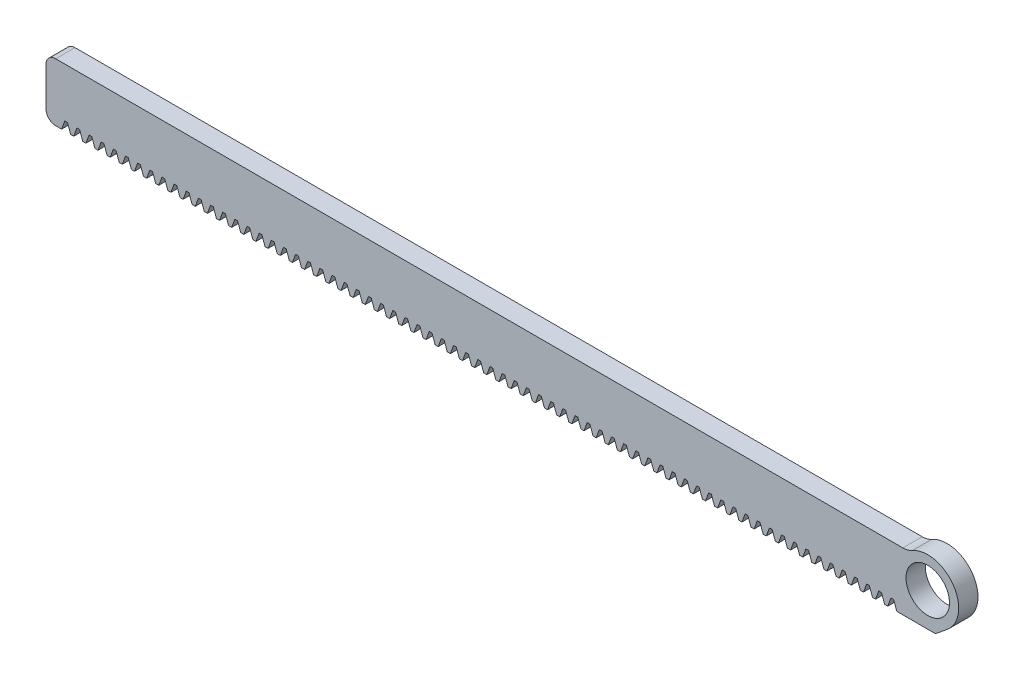
from build123d import *

# Parameters (mm, degrees)
SKETCH1_R           = 14.2875
BOSS_EXTRUDE1_DEPTH = 12.7
FILLET2_R           = 6.35
CUT_EXTRUDE1_DEPTH  = 602.073865732
LPATTERN1_COUNT     = 69
LPATTERN1_PITCH     = 7.979645331


with BuildPart() as part:
    # Sketch1 → Boss-Extrude1 (new body)
    with BuildSketch(Plane.XY):
        with BuildLine():
            Line((0, 38.1), (0, 0))
            Line((0, 0), (584.2, 0))
            Line((584.2, 0), (591.999845733, 6.392013322))
            ThreePointArc((591.999845733, 6.392013322), (595.86597303, 33.618397114), (569.06216832, 39.764856886))
            ThreePointArc((569.06216832, 39.764856886), (566.027460313, 38.523267586), (562.77602352, 38.1))
            Line((562.77602352, 38.1), (0, 38.1))
        make_face()
        with Locations((579.12, 22.108627903)):
            Circle(SKETCH1_R, mode=Mode.SUBTRACT)
    extrude(amount=BOSS_EXTRUDE1_DEPTH)

    # Fillet2
    fillet2_edges = [part.edges().sort_by_distance(p)[0] for p in [
        (0, 0, 6.35),
        (0, 38.1, 6.35),
    ]]
    fillet(fillet2_edges, radius=FILLET2_R)

    # Sketch2 → Cut-Extrude1 (cut, through all)
    with BuildSketch(Plane.XY.offset(12.7)):
        Polygon((552.86876001, 0), (558.8, 0), (556.719910111, 5.715), (554.948849899, 5.715), align=None)
    cut_extrude1 = extrude(amount=-CUT_EXTRUDE1_DEPTH, mode=Mode.SUBTRACT)

    # LPattern1: Cut-Extrude1 ×69
    with Locations(*[(-i * LPATTERN1_PITCH, 0, 0) for i in range(1, LPATTERN1_COUNT)]):
        add(cut_extrude1, mode=Mode.SUBTRACT)


solid = part.part
